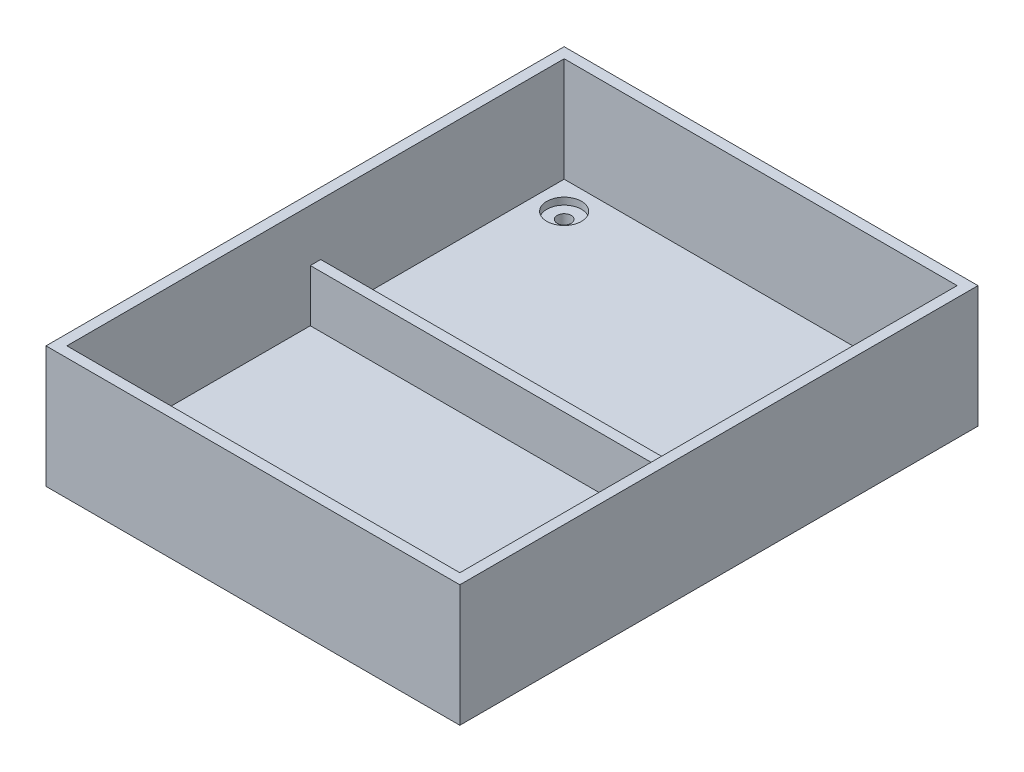
from build123d import *

# Parameters (mm, degrees)
BOSS_EXTRUDE1_DEPTH = 5
SKETCH3_W           = 119
SKETCH3_H           = 149
SKETCH3_W_2         = 113
SKETCH3_H_2         = 70
BOSS_EXTRUDE3_DEPTH = 30
SKETCH7_W           = 113
SKETCH7_H           = 3
CUT_EXTRUDE2_DEPTH  = 15
SKETCH8_R           = 5
CUT_EXTRUDE3_DEPTH  = 2
SKETCH9_R           = 2
CUT_EXTRUDE4_DEPTH  = 15


with BuildPart() as part:
    # Sketch2 → Boss-Extrude1 (new body)
    with BuildSketch(Plane(origin=(0, 0, 0), x_dir=(1, 0, 0), z_dir=(0, 1, 0))):
        Polygon((-66.5, 35), (-66.5, 38), (52.5, 38), (52.5, -111), (-66.5, -111), align=None)
    extrude(amount=BOSS_EXTRUDE1_DEPTH)

    # Sketch3 → Boss-Extrude3 (add)
    with BuildSketch(Plane(origin=(0, 5, 0), x_dir=(1, 0, 0), z_dir=(0, 1, 0))):
        with Locations((-7, -36.5)):
            Rectangle(SKETCH3_W, SKETCH3_H)
        with Locations((-7, 0)):
            Rectangle(SKETCH3_W_2, SKETCH3_H_2, mode=Mode.SUBTRACT)
        with Locations((-7, -73)):
            Rectangle(SKETCH3_W_2, SKETCH3_H_2, mode=Mode.SUBTRACT)
    extrude(amount=BOSS_EXTRUDE3_DEPTH)

    # Sketch7 → Cut-Extrude2 (cut)
    with BuildSketch(Plane(origin=(0, 35, 0), x_dir=(1, 0, 0), z_dir=(0, 1, 0))):
        with Locations((-7, -36.5)):
            Rectangle(SKETCH7_W, SKETCH7_H)
    extrude(amount=-CUT_EXTRUDE2_DEPTH, mode=Mode.SUBTRACT)

    # Sketch8 → Cut-Extrude3 (cut)
    with BuildSketch(Plane(origin=(0, 5, 0), x_dir=(1, 0, 0), z_dir=(0, 1, 0))):
        with Locations(Location((-55.5, 27, 0), (0, 0, 270))):
            Circle(SKETCH8_R)
        with Locations(Location((41.5, 27, 0), (0, 0, 90))):
            Circle(SKETCH8_R)
        with Locations(Location((41.5, -100, 0), (0, 0, 270))):
            Circle(SKETCH8_R)
        with Locations(Location((-55.5, -100, 0), (0, 0, 90))):
            Circle(SKETCH8_R)
    extrude(amount=-CUT_EXTRUDE3_DEPTH, mode=Mode.SUBTRACT)

    # Sketch9 → Cut-Extrude4 (cut)
    with BuildSketch(Plane(origin=(0, 3, 0), x_dir=(1, 0, 0), z_dir=(0, 1, 0))):
        with Locations(Location((41.5, 27, 0), (0, 0, 270))):
            Circle(SKETCH9_R)
        with Locations(Location((-55.5, 27, 0), (0, 0, 90))):
            Circle(SKETCH9_R)
        with Locations(Location((41.5, -100, 0), (0, 0, 90))):
            Circle(SKETCH9_R)
        with Locations(Location((-55.5, -100, 0), (0, 0, 270))):
            Circle(SKETCH9_R)
    extrude(amount=-CUT_EXTRUDE4_DEPTH, mode=Mode.SUBTRACT)


solid = part.part
